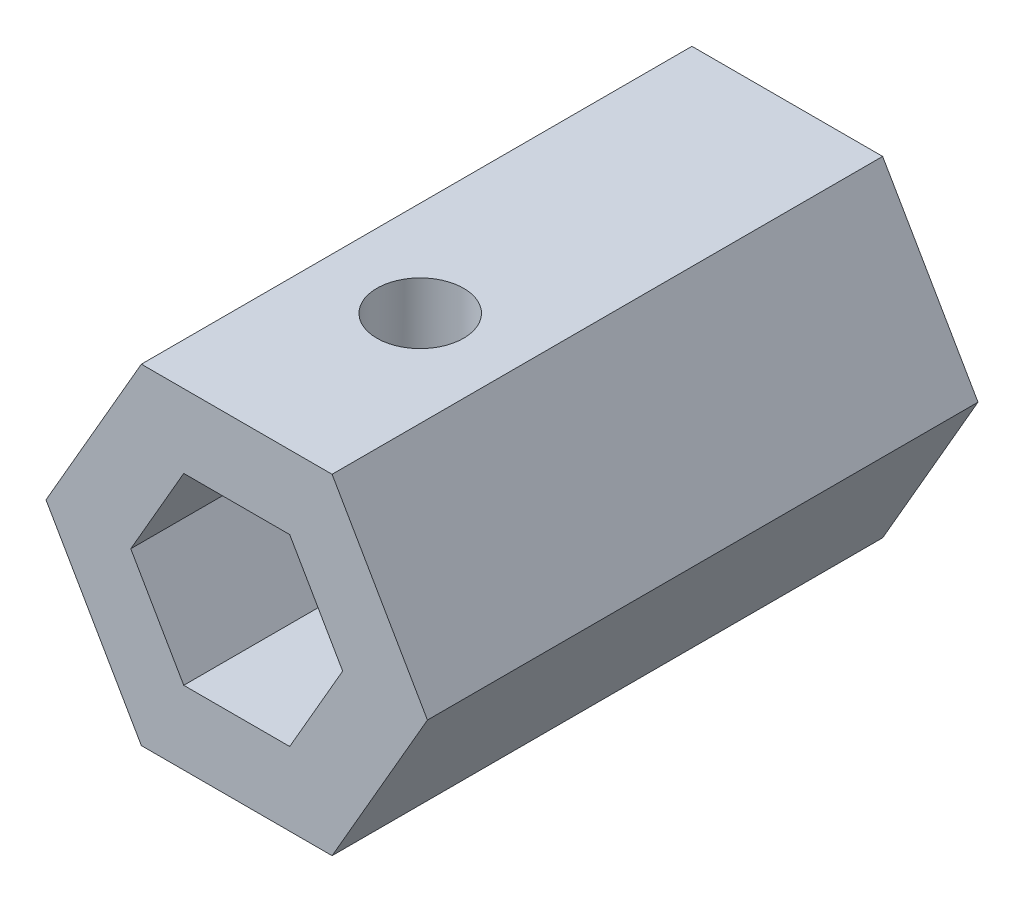
from build123d import *

# Parameters (mm, degrees)
BOSS_EXTRUDE1_DEPTH                       = 2.54
CSK_FOR_8_FLAT_HEAD_MACHINE_SCREW_2_COUNT = 2
CSK_FOR_8_FLAT_HEAD_MACHINE_SCREW_2_PITCH = 18.548356757
BOSS_EXTRUDE2_DEPTH                       = 25.4
M7X1_0_TAPPED_HOLE1_D                     = 6
SKETCH6_R                                 = 6.05
BOSS_EXTRUDE3_DEPTH                       = 12.7


with BuildPart() as part:
    # Sketch1 → Boss-Extrude1 (new body)
    with BuildSketch(Plane.XY):
        Polygon((13.198227154, 0), (6.599113577, 11.43), (-6.599113577, 11.43), (-13.198227154, 0), (-6.599113577, -11.43), (6.599113577, -11.43), align=None)
    extrude(amount=BOSS_EXTRUDE1_DEPTH)

    # Sketch3 → CSK for #8 Flat Head Machine Screw (100)1 (revolve, cut)
    with BuildSketch(Plane(origin=(0, 0, 2.54), x_dir=(0, -1, 0), z_dir=(1, 0, 0))):
        Polygon((0, 0), (0, 2.54), (2.2479, 2.54), (2.2479, 1.651767624), (4.2164, 0), align=None)
    csk_for_8_flat_head_machine_screw_100 = revolve(axis=Axis((0, 0, 8.89), (0, 0, -1)), mode=Mode.SUBTRACT)

    # CSK for _8 Flat Head Machine Screw _ 2: CSK for #8 Flat Head Machine Screw (100)1 ×2
    with Locations(*[Vector(-0.9274068813992224, 0.37405410883101997, 0) * (i * CSK_FOR_8_FLAT_HEAD_MACHINE_SCREW_2_PITCH) for i in range(1, CSK_FOR_8_FLAT_HEAD_MACHINE_SCREW_2_COUNT)]):
        add(csk_for_8_flat_head_machine_screw_100, mode=Mode.SUBTRACT)

    # Sketch1<4> → Boss-Extrude2 (add)
    with BuildSketch(Plane.XY):
        Polygon((6.599113577, 11.43), (-6.599113577, 11.43), (-13.198227154, 0), (-6.599113577, -11.43), (6.599113577, -11.43), (13.198227154, 0), align=None)
        Polygon((3.666174209, -6.35), (7.332348419, 0), (3.666174209, 6.35), (-3.666174209, 6.35), (-7.332348419, 0), (-3.666174209, -6.35), align=None, mode=Mode.SUBTRACT)
    extrude(amount=BOSS_EXTRUDE2_DEPTH)

    # M7x1.0 Tapped Hole1 (through all)
    with Locations(Plane(origin=(0, 11.43, 0), x_dir=(1, 0, 0), z_dir=(0, 1, 0))):
        with Locations((0, -12.7)):
            Hole(M7X1_0_TAPPED_HOLE1_D / 2)

    # Sketch6 → Boss-Extrude3 (add)
    with BuildSketch(Plane(origin=(0, 0, 0), x_dir=(-1, 0, 0), z_dir=(0, 0, -1))):
        Polygon((-13.198227154, 0), (-6.599113577, -11.43), (6.599113577, -11.43), (13.198227154, 0), (6.599113577, 11.43), (-6.599113577, 11.43), align=None)
        Circle(SKETCH6_R, mode=Mode.SUBTRACT)
    extrude(amount=BOSS_EXTRUDE3_DEPTH)


solid = part.part
